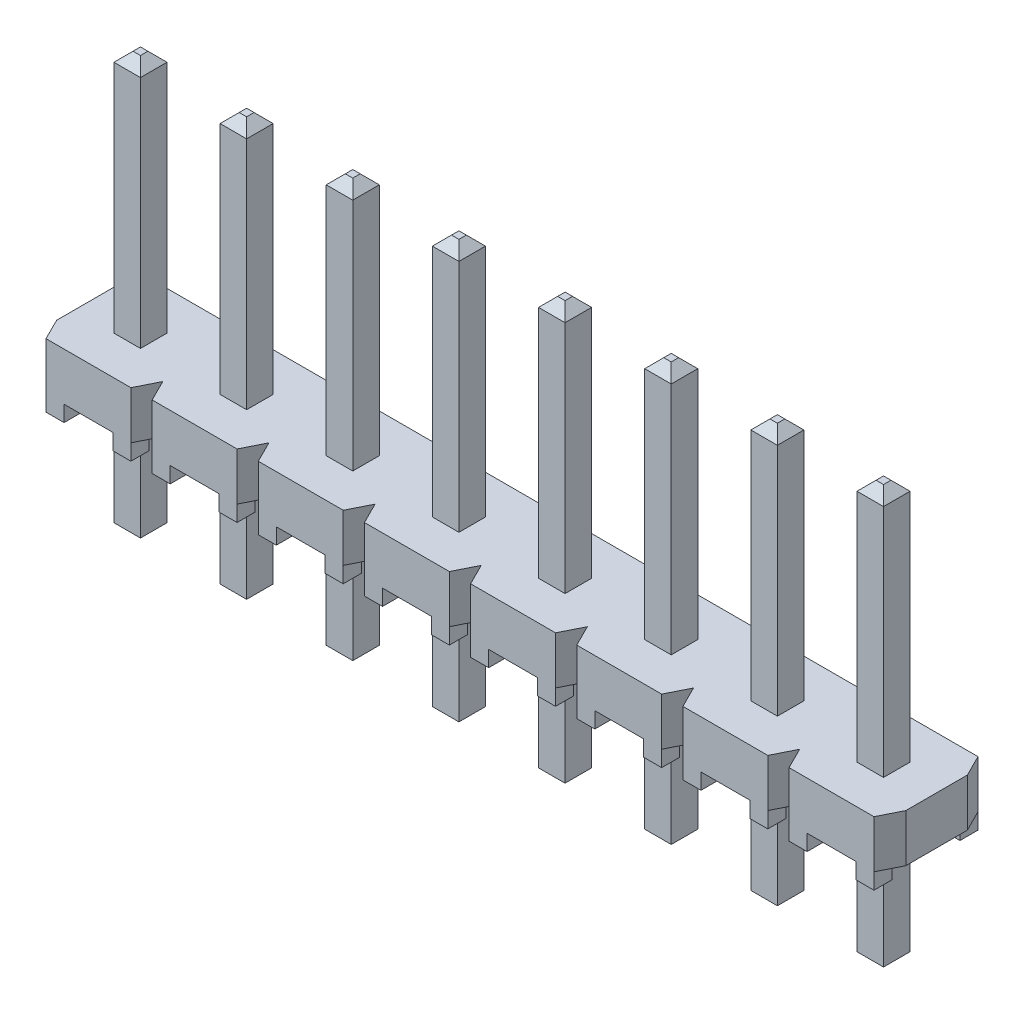
from build123d import *

# Parameters (mm, degrees)
SKETCH1_W                        = 20.32
SKETCH1_H                        = 2.4892
BASE_EXTRUDE_DEPTH               = 0.5715
SNAP_GROOVES_DEPTH               = 11.299566892
SKETCH4_W                        = 0.4318
SKETCH4_H                        = 0.4318
STANDOFFS_DEPTH                  = 0.381
POSITION_PATTERN_COUNT           = 8
POSITION_PATTERN_PITCH           = 2.54
SKETCH5_W                        = 0.635
SKETCH5_H                        = 10
TERMINAL_TH_DEPTH                = 0.3175
T1_TIP1_SIZE                     = 0.2286
TERMINAL_PATTERN_COUNT           = 8
TERMINAL_PATTERN_PITCH           = 2.54
T1_TIP1_OF_TERMINAL_PATTERN_SIZE = 0.2286


with BuildPart() as part:
    # Sketch1 → Base-Extrude (new, symmetric)
    with BuildSketch(Plane(origin=(0, 0, 0), x_dir=(1, 0, 0), z_dir=(0, 1, 0))):
        Rectangle(SKETCH1_W, SKETCH1_H)
    extrude(amount=BASE_EXTRUDE_DEPTH, both=True)

    # Sketch3 → Snap Grooves (cut, through all)
    with BuildSketch(Plane(origin=(0, 0.5715, 0), x_dir=(-1, 0, 0), z_dir=(0, 1, 0))):
        Polygon((7.366, 1.2446), (7.874, 1.2446), (7.62, 0.7366), align=None)
        Polygon((7.366, -1.2446), (7.874, -1.2446), (7.62, -0.7366), align=None)
        Polygon((10.16, -0.7366), (10.414, -1.2446), (9.906, -1.2446), align=None)
        Polygon((10.16, 0.7366), (10.414, 1.2446), (9.906, 1.2446), align=None)
    snap_grooves = extrude(amount=-SNAP_GROOVES_DEPTH, mode=Mode.SUBTRACT)

    # Sketch4 → Standoffs (add)
    with BuildSketch(Plane.XZ.offset(0.5715)):
        with Locations((-9.6901, 1.0287)):
            Rectangle(SKETCH4_W, SKETCH4_H)
        with Locations((-8.0899, 1.0287)):
            Rectangle(SKETCH4_W, SKETCH4_H)
        with Locations((-8.0899, -1.0287)):
            Rectangle(SKETCH4_W, SKETCH4_H)
        with Locations((-9.6901, -1.0287)):
            Rectangle(SKETCH4_W, SKETCH4_H)
    standoffs = extrude(amount=STANDOFFS_DEPTH)

    # Position Pattern: Snap Grooves, Standoffs ×8
    with Locations(*[(i * POSITION_PATTERN_PITCH, 0, 0) for i in range(1, POSITION_PATTERN_COUNT)]):
        add(snap_grooves, mode=Mode.SUBTRACT)
        add(standoffs)

    # Sketch5 → Terminal -TH (add, symmetric)
    with BuildSketch(Plane.ZY.offset(8.89)):
        with Locations((0, 1.4135)):
            Rectangle(SKETCH5_W, SKETCH5_H)
    terminal_th = extrude(amount=TERMINAL_TH_DEPTH, both=True)

    # T1 Tip1
    t1_tip1_edges = [part.edges().sort_by_distance(p)[0] for p in [
        (-8.89, -3.5865, 0.3175),
        (-9.2075, -3.5865, 0),
        (-8.89, 6.4135, -0.3175),
        (-8.5725, -3.5865, 0),
        (-8.89, -3.5865, -0.3175),
        (-8.5725, 6.4135, 0),
        (-8.89, 6.4135, 0.3175),
        (-9.2075, 6.4135, 0),
    ]]
    chamfer(t1_tip1_edges, length=T1_TIP1_SIZE)

    # Terminal Pattern: Terminal -TH ×8
    with Locations(*[(i * TERMINAL_PATTERN_PITCH, 0, 0) for i in range(1, TERMINAL_PATTERN_COUNT)]):
        add(terminal_th)

    # T1 Tip1 of Terminal Pattern
    t1_tip1_of_terminal_pattern_edges = [part.edges().sort_by_distance(p)[0] for p in [
        (-6.35, -3.5865, 0.3175),
        (-6.6675, -3.5865, 0),
        (-6.35, 6.4135, -0.3175),
        (-6.0325, -3.5865, 0),
        (-6.35, -3.5865, -0.3175),
        (-6.0325, 6.4135, 0),
        (-6.35, 6.4135, 0.3175),
        (-6.6675, 6.4135, 0),
        (-3.81, -3.5865, 0.3175),
        (-4.1275, -3.5865, 0),
        (-3.81, 6.4135, -0.3175),
        (-3.4925, -3.5865, 0),
        (-3.81, -3.5865, -0.3175),
        (-3.4925, 6.4135, 0),
        (-3.81, 6.4135, 0.3175),
        (-4.1275, 6.4135, 0),
        (-1.27, -3.5865, 0.3175),
        (-1.5875, -3.5865, 0),
        (-1.27, 6.4135, -0.3175),
        (-0.9525, -3.5865, 0),
        (-1.27, -3.5865, -0.3175),
        (-0.9525, 6.4135, 0),
        (-1.27, 6.4135, 0.3175),
        (-1.5875, 6.4135, 0),
        (1.27, -3.5865, 0.3175),
        (0.9525, -3.5865, 0),
        (1.27, 6.4135, -0.3175),
        (1.5875, -3.5865, 0),
        (1.27, -3.5865, -0.3175),
        (1.5875, 6.4135, 0),
        (1.27, 6.4135, 0.3175),
        (0.9525, 6.4135, 0),
        (3.81, -3.5865, 0.3175),
        (3.4925, -3.5865, 0),
        (3.81, 6.4135, -0.3175),
        (4.1275, -3.5865, 0),
        (3.81, -3.5865, -0.3175),
        (4.1275, 6.4135, 0),
        (3.81, 6.4135, 0.3175),
        (3.4925, 6.4135, 0),
        (6.35, -3.5865, 0.3175),
        (6.0325, -3.5865, 0),
        (6.35, 6.4135, -0.3175),
        (6.6675, -3.5865, 0),
        (6.35, -3.5865, -0.3175),
        (6.6675, 6.4135, 0),
        (6.35, 6.4135, 0.3175),
        (6.0325, 6.4135, 0),
        (8.89, -3.5865, 0.3175),
        (8.5725, -3.5865, 0),
        (8.89, 6.4135, -0.3175),
        (9.2075, -3.5865, 0),
        (8.89, -3.5865, -0.3175),
        (9.2075, 6.4135, 0),
        (8.89, 6.4135, 0.3175),
        (8.5725, 6.4135, 0),
    ]]
    chamfer(t1_tip1_of_terminal_pattern_edges, length=T1_TIP1_OF_TERMINAL_PATTERN_SIZE)


solid = part.part
